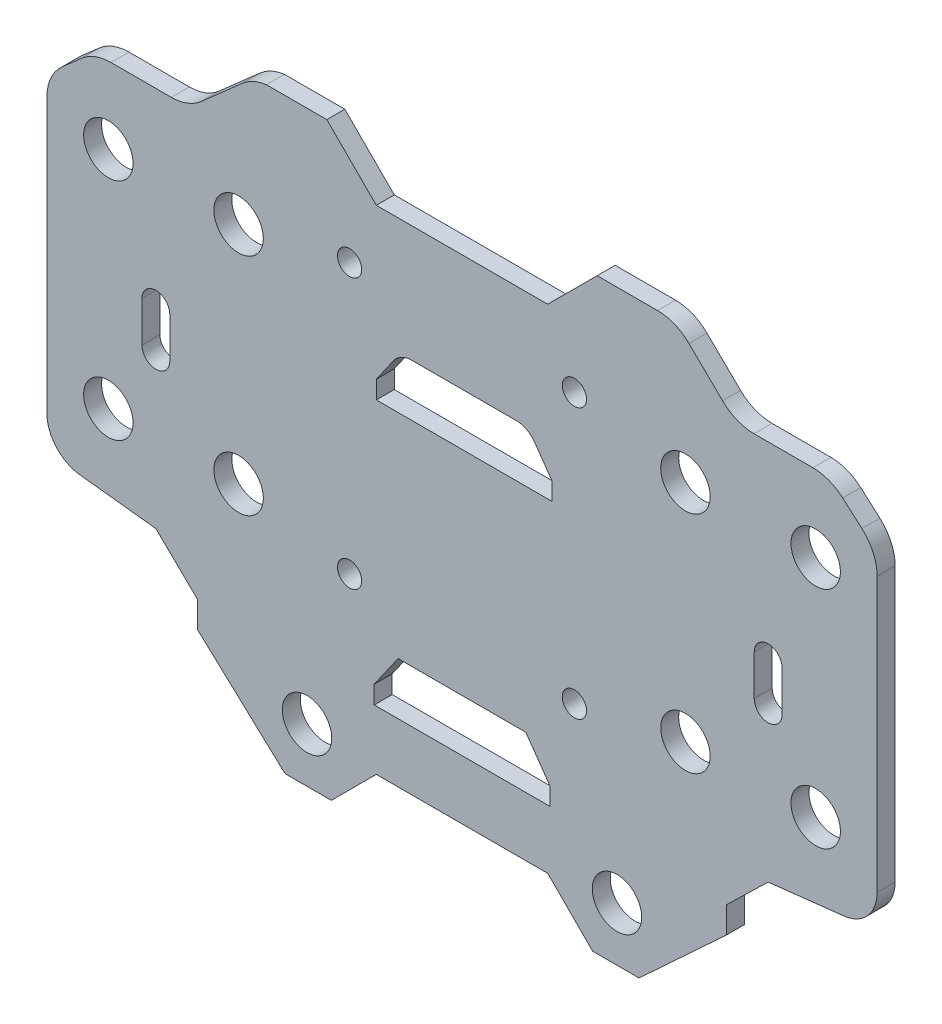
from build123d import *

# Parameters (mm, degrees)
SKETCH_187_R    = 2.75
SKETCH_187_R_2  = 1.35
EXTRUDE_1_DEPTH = 2


with BuildPart() as part:
    # Sketch 187 → 凸台-拉伸1 (new body)
    with BuildSketch(Plane.XY):
        with BuildLine():
            Line((-24.447800114, 142.867788384), (-29.015821613, 138.834288737))
            ThreePointArc((-29.015821613, 138.834288737), (-30.556091587, 137.905760103), (-32.325263946, 137.582300402))
            Line((-32.325263946, 137.582300402), (-39.033457742, 137.582300402))
            ThreePointArc((-39.033457742, 137.582300402), (-40.802630101, 137.2588407), (-42.342900075, 136.330312067))
            Line((-42.342900075, 136.330312067), (-44.480254451, 134.443057788))
            ThreePointArc((-44.480254451, 134.443057788), (-45.728619247, 132.750865708), (-46.170812117, 130.695046123))
            Line((-46.170812117, 130.695046123), (-46.170812117, 100.244585214))
            ThreePointArc((-46.170812117, 100.244585214), (-45.11839985, 97.487233211), (-42.496431366, 96.132300402))
            Line((-42.496431366, 96.132300402), (-34.05, 95.17927075))
            Line((-34.05, 95.17927075), (-29.442356392, 90.712497735))
            Line((-29.442356392, 90.712497735), (-29.442356392, 87.789843939))
            Line((-29.442356392, 87.789843939), (-19.688242157, 78.763336754))
            Line((-19.688242157, 78.763336754), (-14.532154357, 78.763336754))
            Line((-14.532154357, 78.763336754), (-9.532154357, 83.763336754))
            Line((-9.532154357, 83.763336754), (9.532154357, 83.763336754))
            Line((9.532154357, 83.763336754), (14.532154357, 78.763336754))
            Line((14.532154357, 78.763336754), (19.688242157, 78.763336754))
            Line((19.688242157, 78.763336754), (29.442356392, 87.789843939))
            Line((29.442356392, 87.789843939), (29.442356392, 90.712497735))
            Line((29.442356392, 90.712497735), (34.05, 95.17927075))
            Line((34.05, 95.17927075), (42.496431366, 96.132300402))
            ThreePointArc((42.496431366, 96.132300402), (45.11839985, 97.487233211), (46.170812117, 100.244585214))
            Line((46.170812117, 100.244585214), (46.170812117, 130.695046123))
            ThreePointArc((46.170812117, 130.695046123), (45.728619247, 132.750865708), (44.480254451, 134.443057788))
            Line((44.480254451, 134.443057788), (42.342900075, 136.330312067))
            ThreePointArc((42.342900075, 136.330312067), (40.802630101, 137.2588407), (39.033457742, 137.582300402))
            Line((39.033457742, 137.582300402), (32.472417217, 137.582300402))
            ThreePointArc((32.472417217, 137.582300402), (30.584617738, 137.952374579), (28.976268595, 139.007815151))
            Line((28.976268595, 139.007815151), (25.245537252, 142.656785653))
            ThreePointArc((25.245537252, 142.656785653), (23.637188108, 143.712226225), (21.74938863, 144.082300402))
            Line((21.74938863, 144.082300402), (15.032154357, 144.082300402))
            Line((15.032154357, 144.082300402), (9.532154357, 138.582300402))
            Line((9.532154357, 138.582300402), (-9.532154357, 138.582300402))
            Line((-9.532154357, 138.582300402), (-15.032154357, 144.082300402))
            Line((-15.032154357, 144.082300402), (-21.74938863, 144.082300402))
            ThreePointArc((-21.74938863, 144.082300402), (-23.190499918, 143.679240794), (-24.447800114, 142.867788384))
        make_face()
        with Locations((39.335406059, 129.082300402)):
            Circle(SKETCH_187_R, mode=Mode.SUBTRACT)
        with Locations((39.335406059, 104.082300402)):
            Circle(SKETCH_187_R, mode=Mode.SUBTRACT)
        with Locations((17.23796389, 84.763336754)):
            Circle(SKETCH_187_R, mode=Mode.SUBTRACT)
        with Locations(Location((-17.23796389, 84.763336754, 0), (0, 0, 180))):
            Circle(SKETCH_187_R, mode=Mode.SUBTRACT)
        with Locations(Location((-39.335406059, 104.082300402, 0), (0, 0, 180))):
            Circle(SKETCH_187_R, mode=Mode.SUBTRACT)
        with Locations(Location((-39.335406059, 129.082300402, 0), (0, 0, 180))):
            Circle(SKETCH_187_R, mode=Mode.SUBTRACT)
        with Locations(Location((24.85, 129.082300402, 0), (0, 0, 180))):
            Circle(SKETCH_187_R, mode=Mode.SUBTRACT)
        with Locations((-24.85, 129.082300402)):
            Circle(SKETCH_187_R, mode=Mode.SUBTRACT)
        with Locations(Location((-24.85, 104.082300402, 0), (0, 0, 180))):
            Circle(SKETCH_187_R, mode=Mode.SUBTRACT)
        with Locations((24.85, 104.082300402)):
            Circle(SKETCH_187_R, mode=Mode.SUBTRACT)
        with Locations((12.5, 131.582300402)):
            Circle(SKETCH_187_R_2, mode=Mode.SUBTRACT)
        with Locations(Location((-12.5, 131.582300402, 0), (0, 0, 180))):
            Circle(SKETCH_187_R_2, mode=Mode.SUBTRACT)
        with Locations((-12.5, 101.582300402)):
            Circle(SKETCH_187_R_2, mode=Mode.SUBTRACT)
        with Locations(Location((12.5, 101.582300402, 0), (0, 0, 180))):
            Circle(SKETCH_187_R_2, mode=Mode.SUBTRACT)
        Polygon((7.105388598, 96.132300402), (-7.105388598, 96.132300402), (-9.761471208, 92.339021317), (-9.761471208, 90.339021317), (9.761471208, 90.339021317), (9.761471208, 92.339021317), align=None, mode=Mode.SUBTRACT)
        with BuildLine():
            Line((-35.6, 116.582300402), (-35.6, 112.082300402))
            ThreePointArc((-35.6, 112.082300402), (-34.05, 110.532300402), (-32.5, 112.082300402))
            Line((-32.5, 112.082300402), (-32.5, 116.582300402))
            ThreePointArc((-32.5, 116.582300402), (-34.05, 118.132300402), (-35.6, 116.582300402))
        make_face(mode=Mode.SUBTRACT)
        with BuildLine():
            Line((35.6, 116.582300402), (35.6, 112.082300402))
            ThreePointArc((35.6, 112.082300402), (34.05, 110.532300402), (32.5, 112.082300402))
            Line((32.5, 112.082300402), (32.5, 116.582300402))
            ThreePointArc((32.5, 116.582300402), (34.05, 118.132300402), (35.6, 116.582300402))
        make_face(mode=Mode.SUBTRACT)
        with BuildLine():
            Line((6.033287824, 125.625579487), (-5.574654121, 125.625579487))
            ThreePointArc((-5.574654121, 125.625579487), (-6.729025654, 125.34310657), (-7.622534231, 124.559520578))
            Line((-7.622534231, 124.559520578), (-9.532154357, 121.832300402))
            Line((-9.532154357, 121.832300402), (-9.532154357, 119.832300402))
            Line((-9.532154357, 119.832300402), (9.99078806, 119.832300402))
            Line((9.99078806, 119.832300402), (9.99078806, 121.832300402))
            Line((9.99078806, 121.832300402), (8.081167934, 124.559520578))
            ThreePointArc((8.081167934, 124.559520578), (7.187659357, 125.34310657), (6.033287824, 125.625579487))
        make_face(mode=Mode.SUBTRACT)
    extrude(amount=EXTRUDE_1_DEPTH)


solid = part.part
